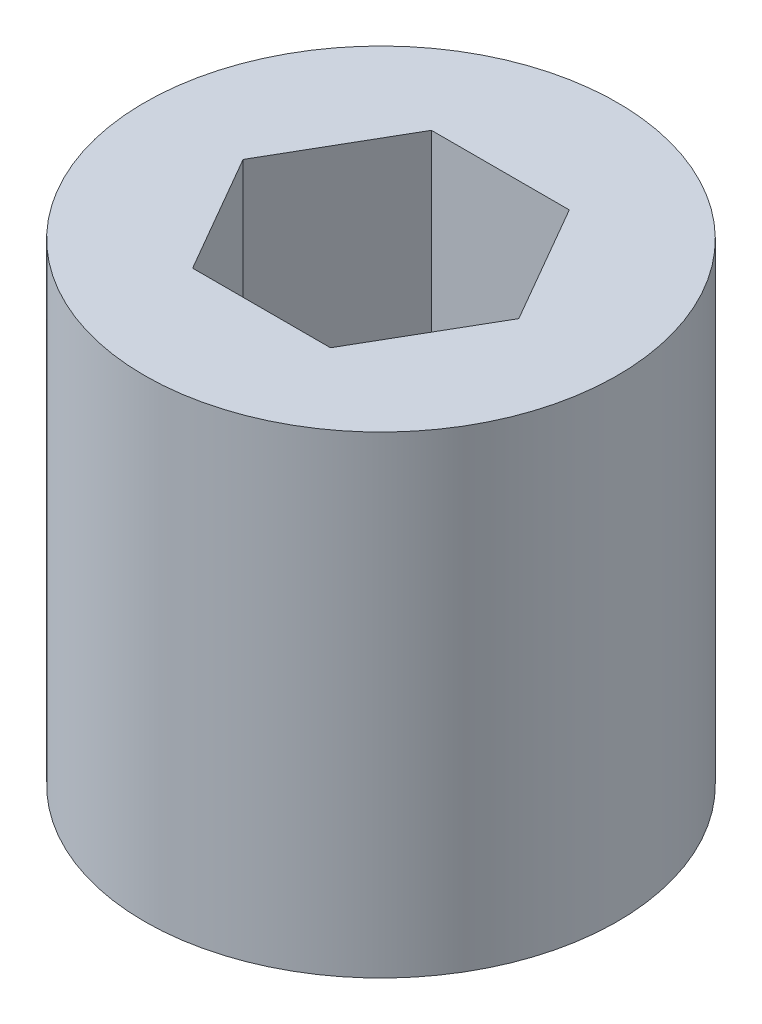
from build123d import *

# Parameters (mm, degrees)
SKETCH1_R           = 12.7
BOSS_EXTRUDE1_DEPTH = 25.4


with BuildPart() as part:
    # Sketch1 → Boss-Extrude1 (new body)
    with BuildSketch(Plane(origin=(0, 0, 0), x_dir=(1, 0, 0), z_dir=(0, 1, 0))):
        with Locations(Location((0, 0, 0), (0, 0, 270))):
            Circle(SKETCH1_R)
        Polygon((7.405671903, 0), (3.702835951, 6.4135), (-3.702835951, 6.4135), (-7.405671903, 0), (-3.702835951, -6.4135), (3.702835951, -6.4135), align=None, mode=Mode.SUBTRACT)
    extrude(amount=BOSS_EXTRUDE1_DEPTH)


solid = part.part
